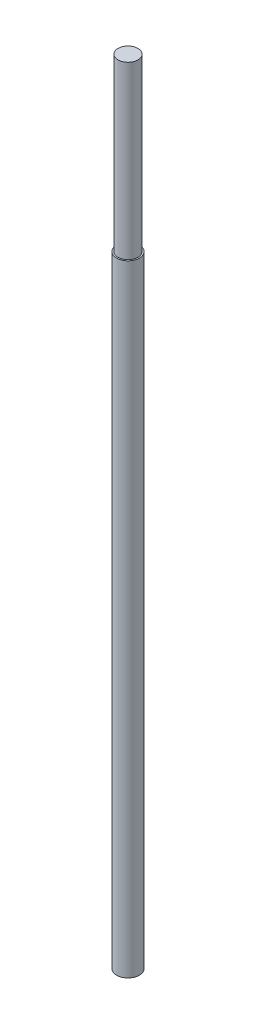
from build123d import *

# Parameters (mm, degrees)
SKETCH1_R           = 4
BOSS_EXTRUDE1_DEPTH = 218
SKETCH2_R           = 3.5
BOSS_EXTRUDE2_DEPTH = 60


with BuildPart() as part:
    # Sketch1 → Boss-Extrude1 (new body)
    with BuildSketch(Plane(origin=(0, 0, 0), x_dir=(1, 0, 0), z_dir=(0, 1, 0))):
        with Locations(Location((0, 0, 0), (0, 0, 270))):
            Circle(SKETCH1_R)
    extrude(amount=BOSS_EXTRUDE1_DEPTH)

    # Sketch2 → Boss-Extrude2 (add)
    with BuildSketch(Plane(origin=(0, 218, 0), x_dir=(1, 0, 0), z_dir=(0, 1, 0))):
        with Locations(Location((0, 0, 0), (0, 0, 270))):
            Circle(SKETCH2_R)
    extrude(amount=BOSS_EXTRUDE2_DEPTH)


solid = part.part
